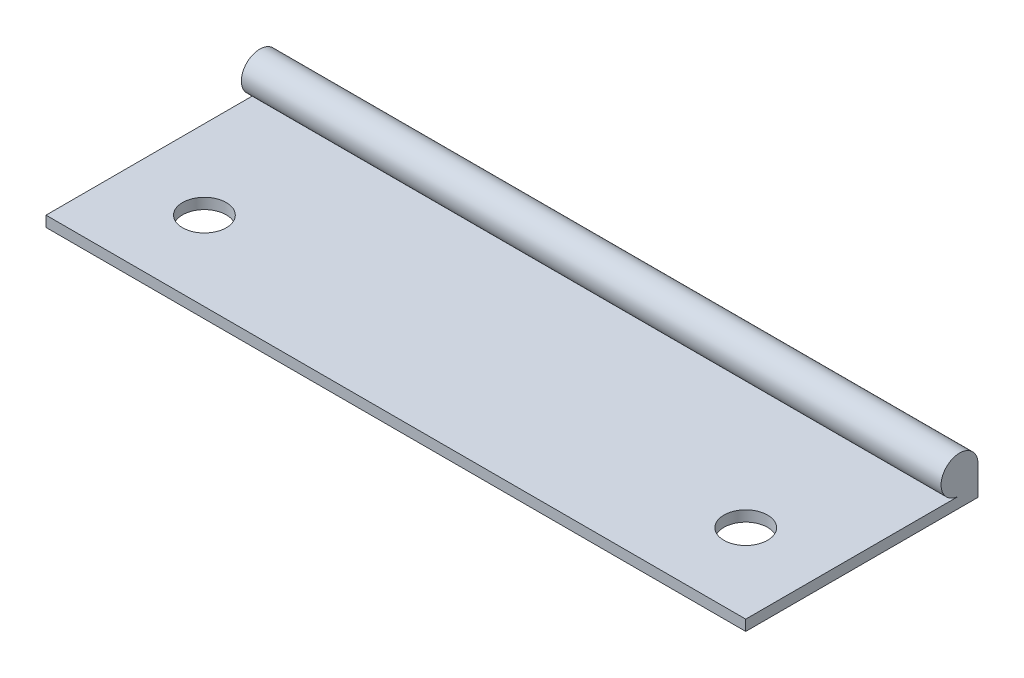
from build123d import *

# Parameters (mm, degrees)
SKETCH_1_R          = 1.9
EXTRUDE_1_DEPTH     = 72
SKETCH_2_R          = 2.25
CUT_EXTRUDE_1_DEPTH = 76.958212196


with BuildPart() as part:
    # 草图1 → 凸台-拉伸1 (new body)
    with BuildSketch(Plane(origin=(0, 0, 0), x_dir=(0, 0, -1), z_dir=(1, 0, 0))):
        with Locations((22, 3)):
            Circle(SKETCH_1_R)
        with BuildLine():
            Line((0, 1.1), (0, 0))
            Line((0, 0), (19, 0))
            Line((19, 0), (23.9, 0))
            Line((23.9, 0), (23.9, 3))
            ThreePointArc((23.9, 3), (23.343502884, 1.656497116), (22, 1.1))
            Line((22, 1.1), (19, 1.1))
            Line((19, 1.1), (0, 1.1))
        make_face()
    extrude(amount=EXTRUDE_1_DEPTH)

    # 草图2 → 切除-拉伸1 (cut, through all)
    with BuildSketch(Plane(origin=(0, 1.1, 0), x_dir=(1, 0, 0), z_dir=(0, 1, 0))):
        with Locations(Location((8.15, 8.15, 0), (0, 0, 270))):
            Circle(SKETCH_2_R)
        with Locations(Location((63.85, 8.15, 0), (0, 0, 270))):
            Circle(SKETCH_2_R)
    extrude(amount=-CUT_EXTRUDE_1_DEPTH, mode=Mode.SUBTRACT)


solid = part.part
